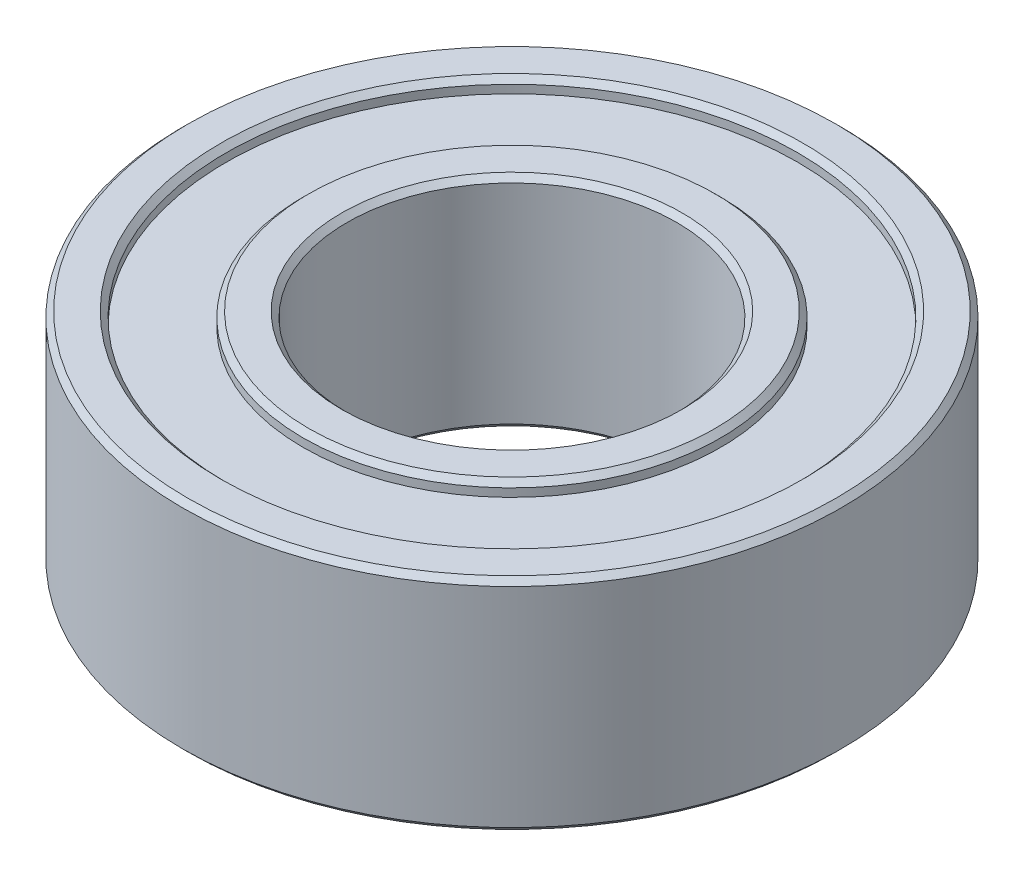
from build123d import *

# Parameters (mm, degrees)
SKETCH1_R             = 6
SKETCH1_R_2           = 5.2
BOSS_EXTRUDE1_DEPTH   = 2
SKETCH1_R_3           = 3.8
SKETCH1_R_4           = 3
BOSS_EXTRUDE1_2_DEPTH = 2
SKETCH1_3_R           = 5.2
SKETCH1_3_R_2         = 3.8
BOSS_EXTRUDE2_DEPTH   = 1.75
CHAMFER2_SIZE         = 0.1
CHAMFER3_SIZE         = 0.1


with BuildPart() as part:
    # Sketch1 → Boss-Extrude1 (new, symmetric)
    with BuildSketch(Plane(origin=(0, 0, 0), x_dir=(1, 0, 0), z_dir=(0, 1, 0))):
        Circle(SKETCH1_R)
        Circle(SKETCH1_R_2, mode=Mode.SUBTRACT)
    extrude(amount=BOSS_EXTRUDE1_DEPTH, both=True)

    # Chamfer3
    chamfer3_edges = [part.edges().sort_by_distance(p)[0] for p in [
        (-5.2, 2, 0),
        (-6, 2, 0),
        (-5.2, -2, 0),
        (-6, -2, 0),
    ]]
    chamfer(chamfer3_edges, length=CHAMFER3_SIZE)


with BuildPart() as body_2:
    # Sketch1 → Boss-Extrude1 2 (new, symmetric)
    with BuildSketch(Plane(origin=(0, 0, 0), x_dir=(1, 0, 0), z_dir=(0, 1, 0))):
        Circle(SKETCH1_R_3)
        Circle(SKETCH1_R_4, mode=Mode.SUBTRACT)
    extrude(amount=BOSS_EXTRUDE1_2_DEPTH, both=True)

    # Sketch1<3> → Boss-Extrude2 (add, symmetric)
    with BuildSketch(Plane(origin=(0, 0, 0), x_dir=(1, 0, 0), z_dir=(0, 1, 0))):
        Circle(SKETCH1_3_R)
        Circle(SKETCH1_3_R_2, mode=Mode.SUBTRACT)
    extrude(amount=BOSS_EXTRUDE2_DEPTH, both=True)

    # Chamfer2
    chamfer2_edges = [body_2.edges().sort_by_distance(p)[0] for p in [
        (-3.8, -2, 0),
        (-3, -2, 0),
        (-3.8, 2, 0),
        (-3, 2, 0),
    ]]
    chamfer(chamfer2_edges, length=CHAMFER2_SIZE)


solid = Compound([part.part, body_2.part])
